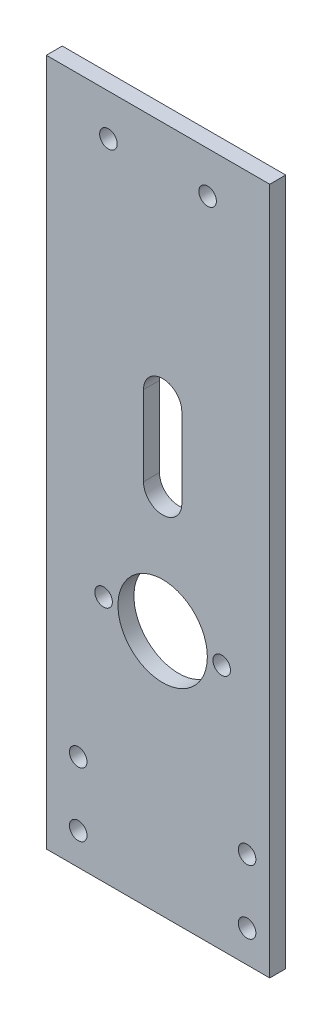
from build123d import *

# Parameters (mm, degrees)
SKETCH1_W           = 70
SKETCH1_H           = 154.713144252
SKETCH1_R           = 2.75
SKETCH1_R_2         = 14
BOSS_EXTRUDE1_DEPTH = 5
SKETCH1_4_W         = 70
SKETCH1_4_H         = 118
SKETCH1_4_R         = 2.75
BOSS_EXTRUDE2_DEPTH = 5
CUT_EXTRUDE1_START  = -10
SKETCH2_W           = 70
SKETCH2_H           = 57.356572126
CUT_EXTRUDE1_DEPTH  = 10


with BuildPart() as part:
    # Sketch1 → Boss-Extrude1 (new body)
    with BuildSketch(Plane.XY):
        with Locations((-1.450472168, 0)):
            Rectangle(SKETCH1_W, SKETCH1_H)
        with Locations((-26.450472168, -10)):
            Circle(SKETCH1_R, mode=Mode.SUBTRACT)
        with BuildLine():
            ThreePointArc((-17.05, -64.643427874), (-15.5, -63.093427874), (-13.95, -64.643427874))
            Line((-13.95, -64.643427874), (-13.95, -71.643427874))
            ThreePointArc((-13.95, -71.643427874), (-15.5, -73.193427874), (-17.05, -71.643427874))
            Line((-17.05, -71.643427874), (-17.05, -64.643427874))
        make_face(mode=Mode.SUBTRACT)
        with BuildLine():
            ThreePointArc((-17.05, -33.643427874), (-15.5, -32.093427874), (-13.95, -33.643427874))
            Line((-13.95, -33.643427874), (-13.95, -40.643427874))
            ThreePointArc((-13.95, -40.643427874), (-15.5, -42.193427874), (-17.05, -40.643427874))
            Line((-17.05, -40.643427874), (-17.05, -33.643427874))
        make_face(mode=Mode.SUBTRACT)
        with Locations((-26.450472168, 10)):
            Circle(SKETCH1_R, mode=Mode.SUBTRACT)
        with Locations((-18.5, 57.356572126)):
            Circle(SKETCH1_R, mode=Mode.SUBTRACT)
        with BuildLine():
            ThreePointArc((12, -56.143427874), (0, -68.143427874), (-12, -56.143427874))
            Line((-12, -56.143427874), (-12, -49.143427874))
            ThreePointArc((-12, -49.143427874), (0, -37.143427874), (12, -49.143427874))
            Line((12, -49.143427874), (12, -56.143427874))
        make_face(mode=Mode.SUBTRACT)
        with BuildLine():
            ThreePointArc((13.95, -64.643427874), (15.5, -63.093427874), (17.05, -64.643427874))
            Line((17.05, -64.643427874), (17.05, -71.643427874))
            ThreePointArc((17.05, -71.643427874), (15.5, -73.193427874), (13.95, -71.643427874))
            Line((13.95, -71.643427874), (13.95, -64.643427874))
        make_face(mode=Mode.SUBTRACT)
        with BuildLine():
            ThreePointArc((13.95, -33.643427874), (15.5, -32.093427874), (17.05, -33.643427874))
            Line((17.05, -33.643427874), (17.05, -40.643427874))
            ThreePointArc((17.05, -40.643427874), (15.5, -42.193427874), (13.95, -40.643427874))
            Line((13.95, -40.643427874), (13.95, -33.643427874))
        make_face(mode=Mode.SUBTRACT)
        with Locations((26.450472168, -10)):
            Circle(SKETCH1_R, mode=Mode.SUBTRACT)
        with Locations((0, 57.356572126)):
            Circle(SKETCH1_R_2, mode=Mode.SUBTRACT)
        with Locations((26.450472168, 10)):
            Circle(SKETCH1_R, mode=Mode.SUBTRACT)
        with Locations((18.5, 57.356572126)):
            Circle(SKETCH1_R, mode=Mode.SUBTRACT)
    extrude(amount=BOSS_EXTRUDE1_DEPTH)

    # Sketch1<4> → Boss-Extrude2 (add)
    with BuildSketch(Plane.XY):
        with Locations((-1.450472168, 136.356572126)):
            Rectangle(SKETCH1_4_W, SKETCH1_4_H)
        with Locations((-16.991825546, 182.387739686)):
            Circle(SKETCH1_4_R, mode=Mode.SUBTRACT)
        with BuildLine():
            ThreePointArc((-6, 119.856572126), (0, 125.856572126), (6, 119.856572126))
            Line((6, 119.856572126), (6, 94.856572126))
            ThreePointArc((6, 94.856572126), (0, 88.856572126), (-6, 94.856572126))
            Line((-6, 94.856572126), (-6, 119.856572126))
        make_face(mode=Mode.SUBTRACT)
        with Locations((14.09088121, 182.387739686)):
            Circle(SKETCH1_4_R, mode=Mode.SUBTRACT)
    extrude(amount=BOSS_EXTRUDE2_DEPTH)

    # Sketch2 → Cut-Extrude1 (cut)
    with BuildSketch(Plane.XY.offset(5).offset(CUT_EXTRUDE1_START)):
        with Locations((-1.450472168, -48.678286063)):
            Rectangle(SKETCH2_W, SKETCH2_H)
        with BuildLine():
            Line((-13.95, -64.643427874), (-13.95, -71.643427874))
            ThreePointArc((-13.95, -71.643427874), (-15.5, -73.193427874), (-17.05, -71.643427874))
            Line((-17.05, -71.643427874), (-17.05, -64.643427874))
            ThreePointArc((-17.05, -64.643427874), (-15.5, -63.093427874), (-13.95, -64.643427874))
        make_face(mode=Mode.SUBTRACT)
        with BuildLine():
            Line((-13.95, -33.643427874), (-13.95, -40.643427874))
            ThreePointArc((-13.95, -40.643427874), (-15.5, -42.193427874), (-17.05, -40.643427874))
            Line((-17.05, -40.643427874), (-17.05, -33.643427874))
            ThreePointArc((-17.05, -33.643427874), (-15.5, -32.093427874), (-13.95, -33.643427874))
        make_face(mode=Mode.SUBTRACT)
        with BuildLine():
            Line((-12, -56.143427874), (-12, -49.143427874))
            ThreePointArc((-12, -49.143427874), (0, -37.143427874), (12, -49.143427874))
            Line((12, -49.143427874), (12, -56.143427874))
            ThreePointArc((12, -56.143427874), (0, -68.143427874), (-12, -56.143427874))
        make_face(mode=Mode.SUBTRACT)
        with BuildLine():
            Line((17.05, -64.643427874), (17.05, -71.643427874))
            ThreePointArc((17.05, -71.643427874), (15.5, -73.193427874), (13.95, -71.643427874))
            Line((13.95, -71.643427874), (13.95, -64.643427874))
            ThreePointArc((13.95, -64.643427874), (15.5, -63.093427874), (17.05, -64.643427874))
        make_face(mode=Mode.SUBTRACT)
        with BuildLine():
            Line((17.05, -33.643427874), (17.05, -40.643427874))
            ThreePointArc((17.05, -40.643427874), (15.5, -42.193427874), (13.95, -40.643427874))
            Line((13.95, -40.643427874), (13.95, -33.643427874))
            ThreePointArc((13.95, -33.643427874), (15.5, -32.093427874), (17.05, -33.643427874))
        make_face(mode=Mode.SUBTRACT)
    extrude(amount=CUT_EXTRUDE1_DEPTH, mode=Mode.SUBTRACT)


solid = part.part
